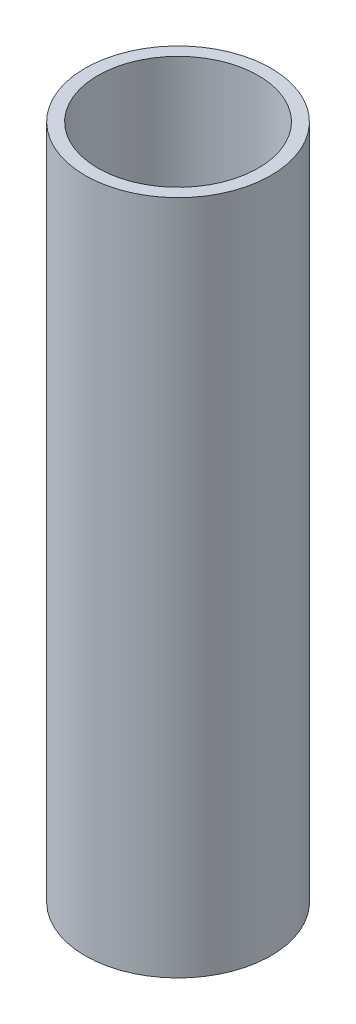
from build123d import *

# Parameters (mm, degrees)
SKETCH1_R           = 11
SKETCH1_R_2         = 9.5
BOSS_EXTRUDE1_DEPTH = 80


with BuildPart() as part:
    # Sketch1 → Boss-Extrude1 (new body)
    with BuildSketch(Plane(origin=(0, 0, 0), x_dir=(1, 0, 0), z_dir=(0, 1, 0))):
        with Locations(Location((0, 0, 0), (0, 0, 270))):
            Circle(SKETCH1_R)
        with Locations(Location((0, 0, 0), (0, 0, 270))):
            Circle(SKETCH1_R_2, mode=Mode.SUBTRACT)
    extrude(amount=BOSS_EXTRUDE1_DEPTH)


solid = part.part
